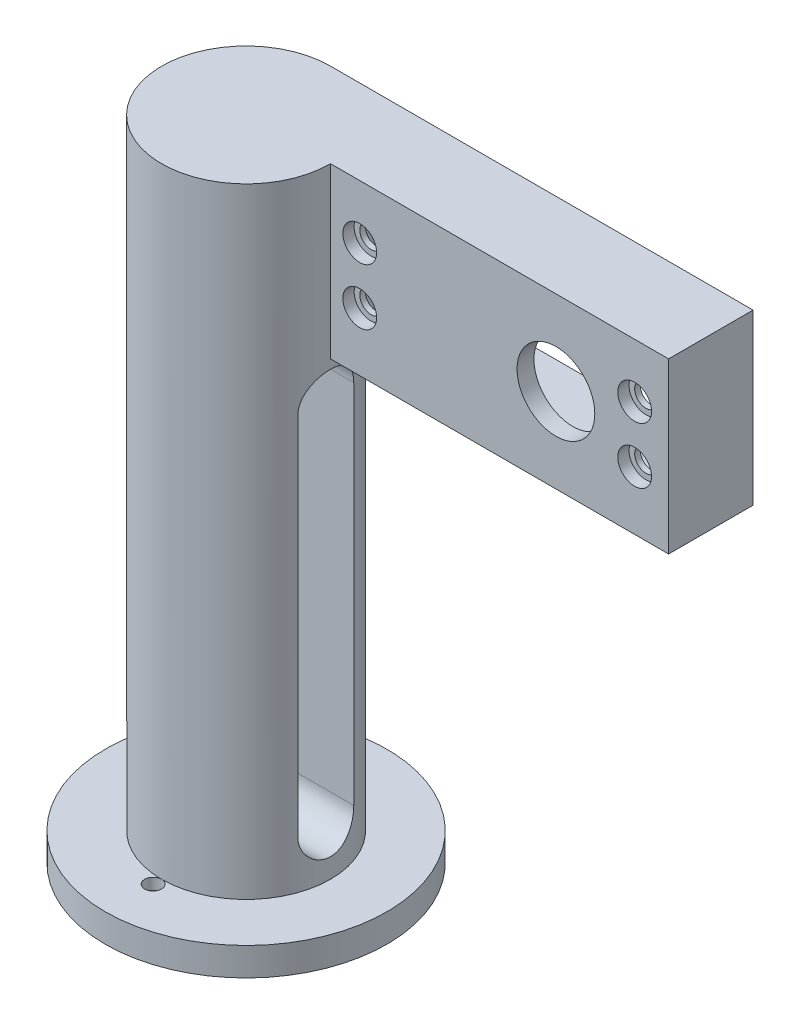
from build123d import *

# Parameters (mm, degrees)
SKETCH1_R           = 25
BOSS_EXTRUDE1_DEPTH = 5
SKETCH2_R           = 15
BOSS_EXTRUDE2_DEPTH = 95
BOSS_EXTRUDE4_DEPTH = 15
CUT_EXTRUDE1_DEPTH  = 20
SKETCH15_W          = 56
SKETCH15_H          = 21
CUT_EXTRUDE3_DEPTH  = 12
SKETCH17_R          = 2
SKETCH17_R_2        = 6.9
CUT_EXTRUDE4_DEPTH  = 5
SKETCH20_R          = 3
CUT_EXTRUDE5_DEPTH  = 2
SKETCH22_R          = 3
SKETCH22_R_2        = 1.5
CUT_EXTRUDE6_DEPTH  = 10
CUT_EXTRUDE7_DEPTH  = 3
SKETCH24_R          = 6.5
CUT_EXTRUDE8_DEPTH  = 3


with BuildPart() as part:
    # Sketch1 → Boss-Extrude1 (new body)
    with BuildSketch(Plane(origin=(0, 0, 0), x_dir=(1, 0, 0), z_dir=(0, 1, 0))):
        with Locations(Location((0, 0, 0), (0, 0, 270))):
            Circle(SKETCH1_R)
    extrude(amount=BOSS_EXTRUDE1_DEPTH)

    # Sketch2 → Boss-Extrude2 (add)
    with BuildSketch(Plane(origin=(0, 5, 0), x_dir=(1, 0, 0), z_dir=(0, 1, 0))):
        with Locations(Location((0, 0, 0), (0, 0, 270))):
            Circle(SKETCH2_R)
    extrude(amount=BOSS_EXTRUDE2_DEPTH)

    # Sketch5 → Boss-Extrude4 (add, symmetric)
    with BuildSketch(Plane(origin=(0, 100, 0), x_dir=(1, 0, 0), z_dir=(0, 1, 0))):
        with BuildLine():
            Line((75, 0), (15, 0))
            ThreePointArc((15, 0), (-10.606601718, -10.606601718), (0, 15))
            Line((0, 15), (75, 15))
            Line((75, 15), (75, 0))
        make_face()
    extrude(amount=BOSS_EXTRUDE4_DEPTH, both=True)

    # Sketch13 → Cut-Extrude1 (cut, symmetric)
    with BuildSketch(Plane(origin=(0, 0, 0), x_dir=(0, 0, -1), z_dir=(1, 0, 0))):
        with BuildLine():
            Line((4.957382287, 78.443263872), (4.957382287, 13.443263872))
            ThreePointArc((4.957382287, 13.443263872), (0, 8.485881586), (-4.957382287, 13.443263872))
            Line((-4.957382287, 13.443263872), (-4.957382287, 78.443263872))
            ThreePointArc((-4.957382287, 78.443263872), (0, 83.400646159), (4.957382287, 78.443263872))
        make_face()
    extrude(amount=CUT_EXTRUDE1_DEPTH, both=True, mode=Mode.SUBTRACT)

    # Sketch15 → Cut-Extrude3 (cut)
    with BuildSketch(Plane(origin=(0, 0, -15), x_dir=(-1, 0, 0), z_dir=(0, 0, -1))):
        with Locations((-44.68, 100.4)):
            Rectangle(SKETCH15_W, SKETCH15_H)
    extrude(amount=-CUT_EXTRUDE3_DEPTH, mode=Mode.SUBTRACT)

    # Sketch17 → Cut-Extrude4 (cut)
    with BuildSketch(Plane(origin=(0, 0, -3), x_dir=(-1, 0, 0), z_dir=(0, 0, -1))):
        with Locations((-68.98, 105.4)):
            Circle(SKETCH17_R)
        with Locations((-68.98, 95.4)):
            Circle(SKETCH17_R)
        with Locations((-20.18, 105.4)):
            Circle(SKETCH17_R)
        with Locations((-20.18, 95.4)):
            Circle(SKETCH17_R)
        with Locations((-55, 100)):
            Circle(SKETCH17_R_2)
    extrude(amount=-CUT_EXTRUDE4_DEPTH, mode=Mode.SUBTRACT)

    # Sketch20 → Cut-Extrude5 (cut)
    with BuildSketch(Plane.XY):
        with Locations((20.18, 105.4)):
            Circle(SKETCH20_R)
        with Locations((20.18, 95.4)):
            Circle(SKETCH20_R)
        with Locations((68.98, 105.4)):
            Circle(SKETCH20_R)
        with Locations((68.98, 95.4)):
            Circle(SKETCH20_R)
    extrude(amount=-CUT_EXTRUDE5_DEPTH, mode=Mode.SUBTRACT)

    # Sketch22 → Cut-Extrude6 (cut)
    with BuildSketch(Plane.XZ):
        with Locations(Location((0, 0, 0), (0, 0, 270))):
            Circle(SKETCH22_R)
        with Locations(Location((0, 16.5, 0), (0, 0, 270))):
            Circle(SKETCH22_R_2)
        with Locations(Location((0, -16.5, 0), (0, 0, 270))):
            Circle(SKETCH22_R_2)
    extrude(amount=-CUT_EXTRUDE6_DEPTH, mode=Mode.SUBTRACT)

    # Sketch23 → Cut-Extrude7 (cut)
    with BuildSketch(Plane.XZ):
        with BuildLine():
            Line((4.75, 15), (4.75, -15))
            ThreePointArc((4.75, -15), (0, -19.75), (-4.75, -15))
            Line((-4.75, -15), (-4.75, 15))
            ThreePointArc((-4.75, 15), (0, 19.75), (4.75, 15))
        make_face()
    extrude(amount=-CUT_EXTRUDE7_DEPTH, mode=Mode.SUBTRACT)

    # Sketch24 → Cut-Extrude8 (cut)
    with BuildSketch(Plane.XZ.offset(-3)):
        Circle(SKETCH24_R)
    extrude(amount=CUT_EXTRUDE8_DEPTH, mode=Mode.SUBTRACT)


solid = part.part
